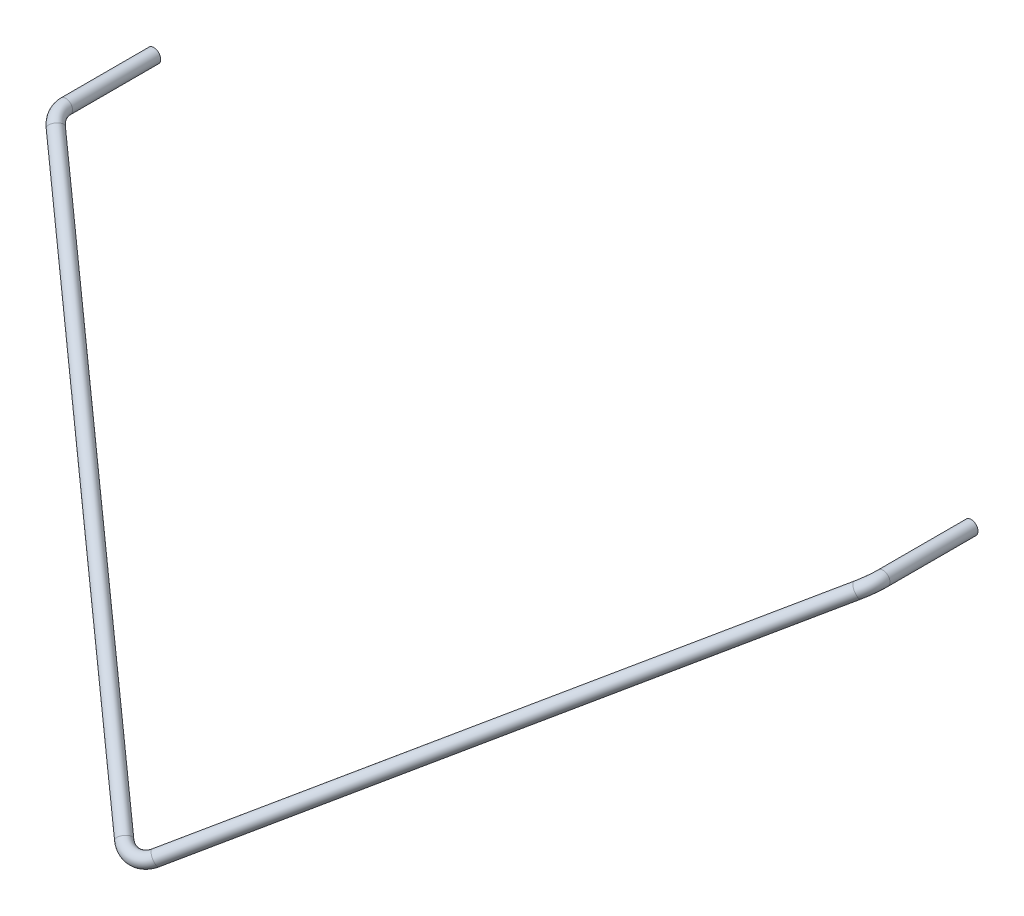
from build123d import *

# Parameters (mm, degrees)
CROQUIS5_R = 25.4


with BuildPart() as part:
    # Barrer1: sweep along a curve in space
    with BuildLine() as barrer1_path:
        Line((-1520, 0, -370), (-1520, 0, -42.462209189))
        ThreePointArc((-1520, 0, -42.462209189), (-1512.31780522, -5.306779289, -4.955826649), (-1491.064421296, -19.988393184, 23.795706171))
        Line((-1491.064421296, -19.988393184, 23.795706171), (-58.549689027, -1009.554491133, 1201.850584682))
        ThreePointArc((-58.549689027, -1009.554491133, 1201.850584682), (0, -1025.945954224, 1221.364231219), (58.549689027, -1009.554491133, 1201.850584682))
        Line((58.549689027, -1009.554491133, 1201.850584682), (1491.064421296, -19.988393184, 23.795706171))
        ThreePointArc((1491.064421296, -19.988393184, 23.795706171), (1512.31780522, -5.306779289, -4.955826649), (1520, 0, -42.462209189))
        Line((1520, 0, -42.462209189), (1520, 0, -370))
    # Croquis5 → Barrer1 (sweep)
    with BuildSketch(Plane.XY.offset(-370)):
        with Locations((-1520, 0)):
            Circle(CROQUIS5_R)
    sweep(path=barrer1_path.line)


solid = part.part
